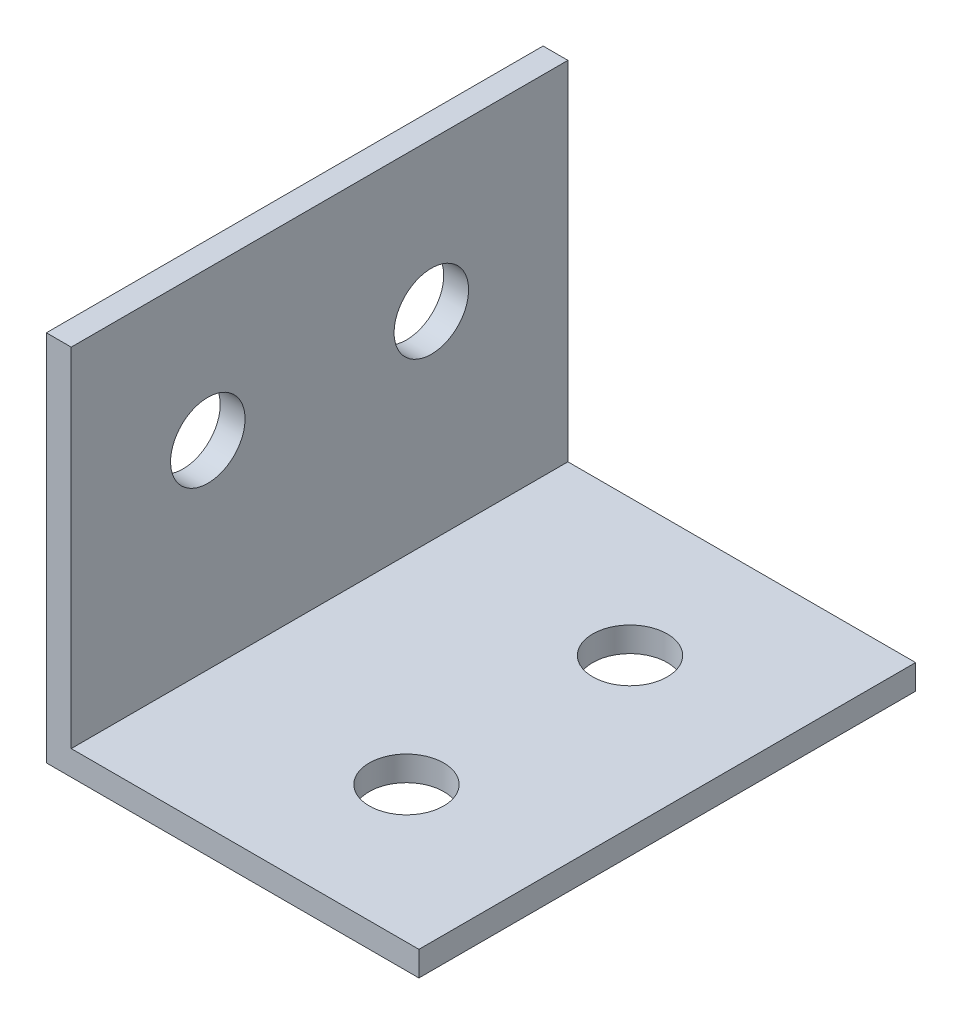
from build123d import *

# Parameters (mm, degrees)
EXTRUDE_1_DEPTH     = 20
SKETCH_2_R          = 1.5
CUT_EXTRUDE_1_DEPTH = 29.142494559


with BuildPart() as part:
    # 草图1 → 凸台-拉伸1 (new body)
    with BuildSketch(Plane.XY):
        Polygon((0, 0), (0, 14), (-1, 14), (-1, -1), (14, -1), (14, 0), align=None)
    extrude(amount=EXTRUDE_1_DEPTH)

    # 草图2 → 切除-拉伸1 (cut, through all)
    with BuildSketch(Plane(origin=(0, 0, 0), x_dir=(1, 0, 0), z_dir=(0, 1, 0))):
        with Locations(Location((8, -5.5, 0), (0, 0, 180))):
            Circle(SKETCH_2_R)
        with Locations((8, -14.5)):
            Circle(SKETCH_2_R)
    cut_extrude_1 = extrude(amount=-CUT_EXTRUDE_1_DEPTH, mode=Mode.SUBTRACT)

    # 镜向1: 切除-拉伸1 across plane
    add(cut_extrude_1.mirror(Plane(origin=(0, 0, 0), x_dir=(0, 0, 1), z_dir=(-0.7071067811865476, 0.7071067811865475, 0))), mode=Mode.SUBTRACT)


solid = part.part
